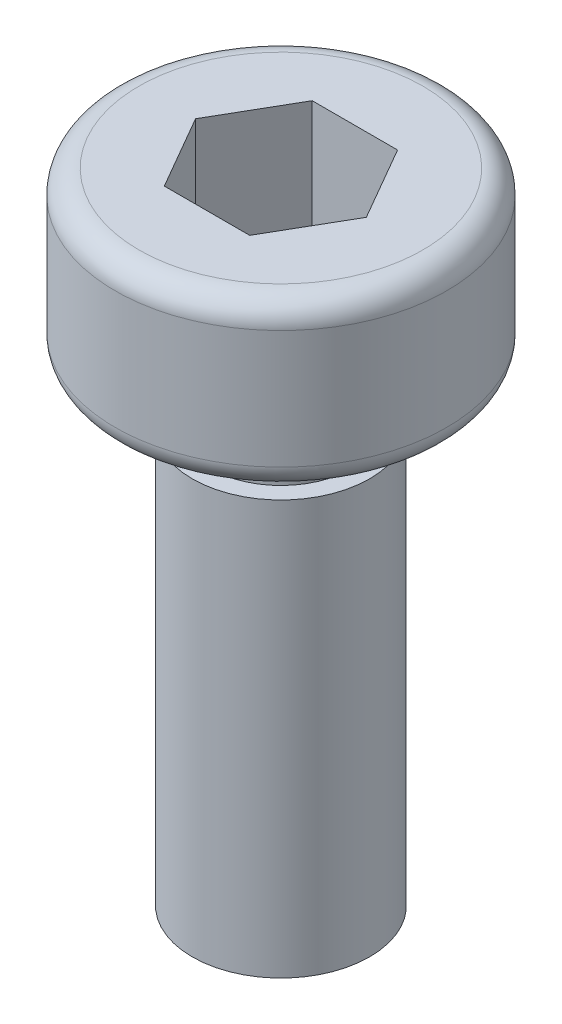
from build123d import *

# Parameters (mm, degrees)
CUT_EXTRUDE_1_DEPTH = 2


with BuildPart() as part:
    # 草图1 → 旋转1 (revolve)
    with BuildSketch(Plane.XY, mode=Mode.PRIVATE) as revolve_1_sk:
        with BuildLine():
            Line((0, 10.8), (-2.4, 10.8))
            ThreePointArc((-2.4, 10.8), (-2.682842712, 10.682842712), (-2.8, 10.4))
            Line((-2.8, 10.4), (-2.8, 8.4))
            ThreePointArc((-2.8, 8.4), (-2.682842712, 8.117157288), (-2.4, 8))
            Line((-2.4, 8), (-1.2, 8))
            Line((-1.2, 8), (-1.2, 7))
            Line((-1.2, 7), (-1.5, 7))
            Line((-1.5, 7), (-1.5, 0))
            Line((-1.5, 0), (0, 0))
            Line((0, 0), (0, 10.8))
        make_face()
    revolve(revolve_1_sk.sketch.rotate(Axis((0, 0, 0), (0, 1, 0)), 270), axis=Axis((0, 0, 0), (0, 1, 0)))

    # 草图2 → 切除-拉伸1 (cut)
    with BuildSketch(Plane(origin=(0, 10.8, 0), x_dir=(1, 0, 0), z_dir=(0, 1, 0))):
        Polygon((-0.721687836, 1.25), (-1.443375673, 0), (-0.721687836, -1.25), (0.721687836, -1.25), (1.443375673, 0), (0.721687836, 1.25), align=None)
    extrude(amount=-CUT_EXTRUDE_1_DEPTH, mode=Mode.SUBTRACT)


solid = part.part
